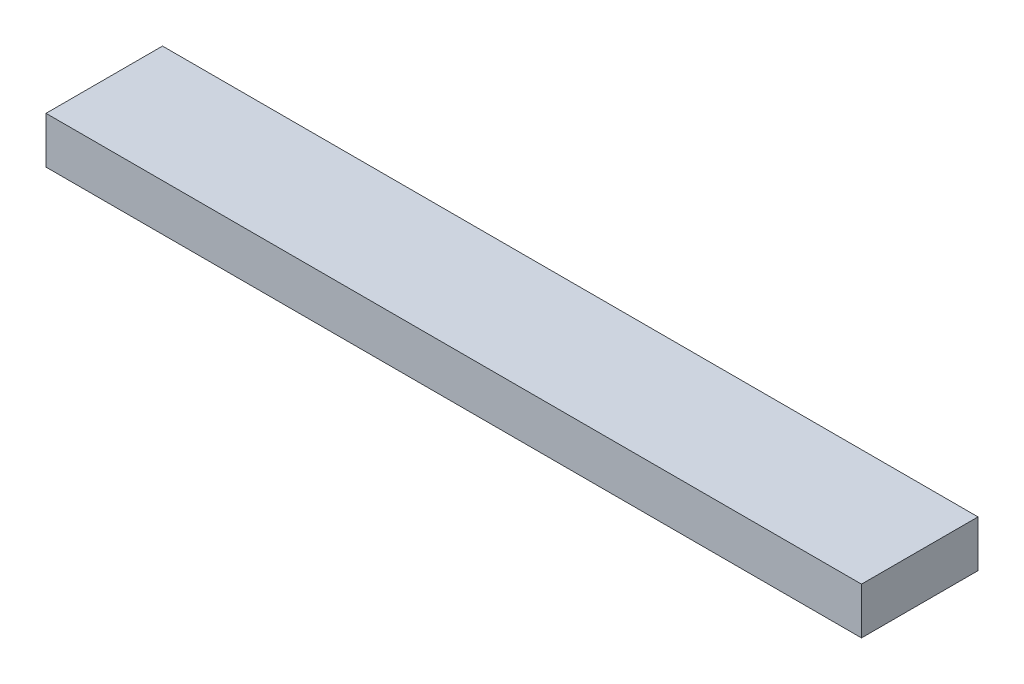
from build123d import *

# Parameters (mm, degrees)
SKETCH1_W           = 350
SKETCH1_H           = 50
BOSS_EXTRUDE1_DEPTH = 10


with BuildPart() as part:
    # Sketch1 → Boss-Extrude1 (new, symmetric)
    with BuildSketch(Plane(origin=(0, 0, 0), x_dir=(1, 0, 0), z_dir=(0, 1, 0))):
        Rectangle(SKETCH1_W, SKETCH1_H)
    extrude(amount=BOSS_EXTRUDE1_DEPTH, both=True)


solid = part.part
